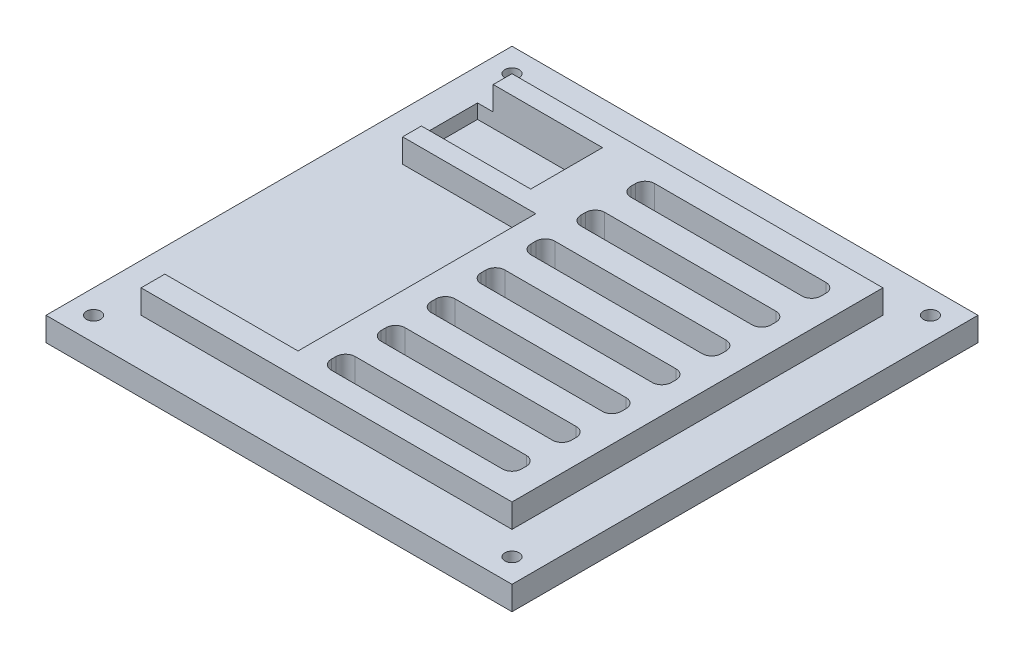
from build123d import *

# Parameters (mm, degrees)
SKETCH1_W           = 98
SKETCH1_H           = 98
BOSS_EXTRUDE1_DEPTH = 10
SKETCH8_W           = 98
SKETCH8_H           = 98
SKETCH8_W_2         = 78
SKETCH8_H_2         = 78
CUT_EXTRUDE5_DEPTH  = 5
SKETCH9_W           = 28
SKETCH9_H           = 50
CUT_EXTRUDE6_DEPTH  = 5
SKETCH11_W          = 22.983747508
SKETCH11_H          = 15.1
CUT_EXTRUDE7_DEPTH  = 8
SKETCH12_W          = 3.3
SKETCH12_H          = 15.1
CUT_EXTRUDE8_DEPTH  = 3
CUT_EXTRUDE10_DEPTH = 16
SKETCH14_R          = 1.5
CUT_EXTRUDE11_DEPTH = 10


with BuildPart() as part:
    # Sketch1 → Boss-Extrude1 (new body)
    with BuildSketch(Plane(origin=(0, 0, 0), x_dir=(1, 0, 0), z_dir=(0, 1, 0))):
        Rectangle(SKETCH1_W, SKETCH1_H)
    extrude(amount=BOSS_EXTRUDE1_DEPTH)

    # Sketch8 → Cut-Extrude5 (cut)
    with BuildSketch(Plane(origin=(0, 10, 0), x_dir=(1, 0, 0), z_dir=(0, 1, 0))):
        Rectangle(SKETCH8_W, SKETCH8_H)
        Rectangle(SKETCH8_W_2, SKETCH8_H_2, mode=Mode.SUBTRACT)
    extrude(amount=-CUT_EXTRUDE5_DEPTH, mode=Mode.SUBTRACT)

    # Sketch9 → Cut-Extrude6 (cut)
    with BuildSketch(Plane(origin=(0, 10, 0), x_dir=(1, 0, 0), z_dir=(0, 1, 0))):
        with Locations((-25, -9)):
            Rectangle(SKETCH9_W, SKETCH9_H)
    extrude(amount=-CUT_EXTRUDE6_DEPTH, mode=Mode.SUBTRACT)

    # Sketch11 → Cut-Extrude7 (cut)
    with BuildSketch(Plane(origin=(0, 10, 0), x_dir=(1, 0, 0), z_dir=(0, 1, 0))):
        with Locations((-27.508126246, 27.5)):
            Rectangle(SKETCH11_W, SKETCH11_H)
    extrude(amount=-CUT_EXTRUDE7_DEPTH, mode=Mode.SUBTRACT)

    # Sketch12 → Cut-Extrude8 (cut)
    with BuildSketch(Plane(origin=(0, 5, 0), x_dir=(1, 0, 0), z_dir=(0, 1, 0))):
        with Locations((-40.65, 27.5)):
            Rectangle(SKETCH12_W, SKETCH12_H)
    extrude(amount=-CUT_EXTRUDE8_DEPTH, mode=Mode.SUBTRACT)

    # Sketch13 → Cut-Extrude10 (cut)
    with BuildSketch(Plane(origin=(0, 10, 0), x_dir=(1, 0, 0), z_dir=(0, 1, 0))):
        with BuildLine():
            Line((-4, -18.5), (32, -18.5))
            ThreePointArc((32, -18.5), (33.414213562, -19.085786438), (34, -20.5))
            Line((34, -20.5), (34, -21.5))
            ThreePointArc((34, -21.5), (33.414213562, -22.914213562), (32, -23.5))
            Line((32, -23.5), (-4, -23.5))
            ThreePointArc((-4, -23.5), (-5.414213562, -22.914213562), (-6, -21.5))
            Line((-6, -21.5), (-6, -20.5))
            ThreePointArc((-6, -20.5), (-5.414213562, -19.085786438), (-4, -18.5))
        make_face()
        with BuildLine():
            Line((-4, -34), (32, -34))
            ThreePointArc((32, -34), (33.414213562, -33.414213562), (34, -32))
            Line((34, -32), (34, -31))
            ThreePointArc((34, -31), (33.414213562, -29.585786438), (32, -29))
            Line((32, -29), (-4, -29))
            ThreePointArc((-4, -29), (-5.414213562, -29.585786438), (-6, -31))
            Line((-6, -31), (-6, -32))
            ThreePointArc((-6, -32), (-5.414213562, -33.414213562), (-4, -34))
        make_face()
        with BuildLine():
            Line((-4, -8), (32, -8))
            ThreePointArc((32, -8), (33.414213562, -8.585786438), (34, -10))
            Line((34, -10), (34, -11))
            ThreePointArc((34, -11), (33.414213562, -12.414213562), (32, -13))
            Line((32, -13), (-4, -13))
            ThreePointArc((-4, -13), (-5.414213562, -12.414213562), (-6, -11))
            Line((-6, -11), (-6, -10))
            ThreePointArc((-6, -10), (-5.414213562, -8.585786438), (-4, -8))
        make_face()
        with BuildLine():
            Line((-4, 2.5), (32, 2.5))
            ThreePointArc((32, 2.5), (33.414213562, 1.914213562), (34, 0.5))
            Line((34, 0.5), (34, -0.5))
            ThreePointArc((34, -0.5), (33.414213562, -1.914213562), (32, -2.5))
            Line((32, -2.5), (-4, -2.5))
            ThreePointArc((-4, -2.5), (-5.414213562, -1.914213562), (-6, -0.5))
            Line((-6, -0.5), (-6, 0.5))
            ThreePointArc((-6, 0.5), (-5.414213562, 1.914213562), (-4, 2.5))
        make_face()
        with BuildLine():
            Line((-4, 13), (32, 13))
            ThreePointArc((32, 13), (33.414213562, 12.414213562), (34, 11))
            Line((34, 11), (34, 10))
            ThreePointArc((34, 10), (33.414213562, 8.585786438), (32, 8))
            Line((32, 8), (-4, 8))
            ThreePointArc((-4, 8), (-5.414213562, 8.585786438), (-6, 10))
            Line((-6, 10), (-6, 11))
            ThreePointArc((-6, 11), (-5.414213562, 12.414213562), (-4, 13))
        make_face()
        with BuildLine():
            Line((-4, 23.5), (32, 23.5))
            ThreePointArc((32, 23.5), (33.414213562, 22.914213562), (34, 21.5))
            Line((34, 21.5), (34, 20.5))
            ThreePointArc((34, 20.5), (33.414213562, 19.085786438), (32, 18.5))
            Line((32, 18.5), (-4, 18.5))
            ThreePointArc((-4, 18.5), (-5.414213562, 19.085786438), (-6, 20.5))
            Line((-6, 20.5), (-6, 21.5))
            ThreePointArc((-6, 21.5), (-5.414213562, 22.914213562), (-4, 23.5))
        make_face()
        with BuildLine():
            Line((-4, 34), (32, 34))
            ThreePointArc((32, 34), (33.414213562, 33.414213562), (34, 32))
            Line((34, 32), (34, 31))
            ThreePointArc((34, 31), (33.414213562, 29.585786438), (32, 29))
            Line((32, 29), (-4, 29))
            ThreePointArc((-4, 29), (-5.414213562, 29.585786438), (-6, 31))
            Line((-6, 31), (-6, 32))
            ThreePointArc((-6, 32), (-5.414213562, 33.414213562), (-4, 34))
        make_face()
    extrude(amount=-CUT_EXTRUDE10_DEPTH, mode=Mode.SUBTRACT)

    # Sketch14 → Cut-Extrude11 (cut)
    with BuildSketch(Plane.XZ):
        with Locations(Location((-44, -44, 0), (0, 0, 270))):
            Circle(SKETCH14_R)
        with Locations(Location((-44, 44, 0), (0, 0, 270))):
            Circle(SKETCH14_R)
        with Locations(Location((44, 44, 0), (0, 0, 270))):
            Circle(SKETCH14_R)
        with Locations(Location((44, -44, 0), (0, 0, 270))):
            Circle(SKETCH14_R)
    extrude(amount=-CUT_EXTRUDE11_DEPTH, mode=Mode.SUBTRACT)


solid = part.part
